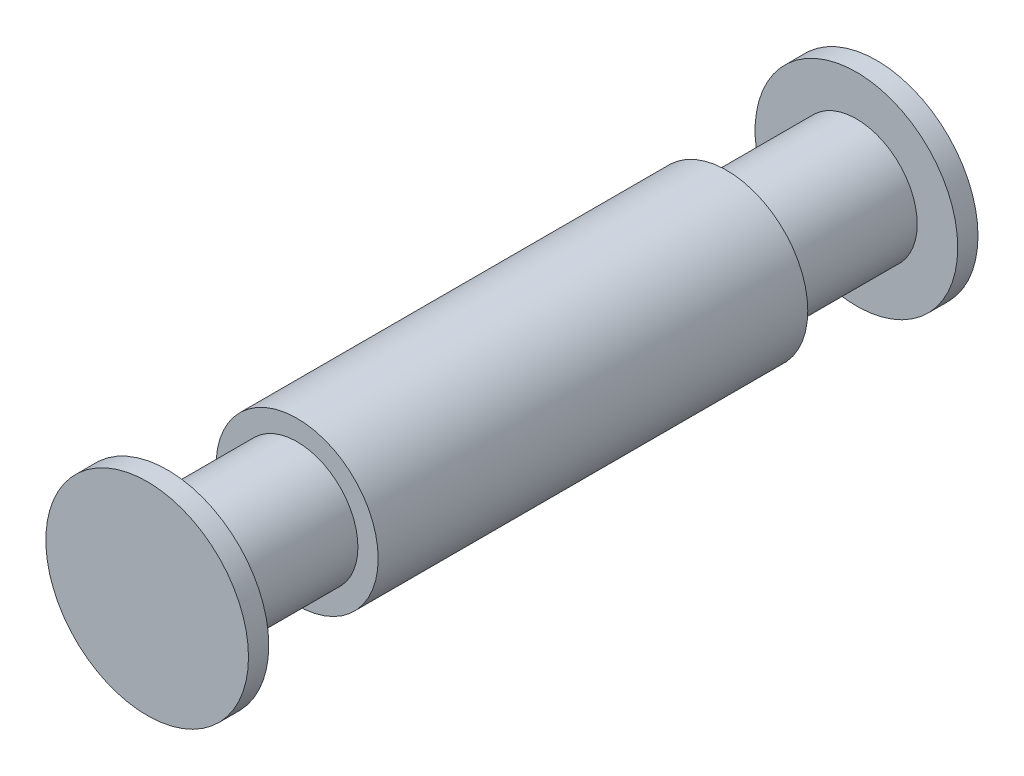
from build123d import *


with BuildPart() as part:
    # Sketch1 → Revolve1 (revolve)
    with BuildSketch(Plane(origin=(0, 0, 0), x_dir=(0, 0, -1), z_dir=(1, 0, 0)), mode=Mode.PRIVATE) as revolve1_sk:
        Polygon((-9, 0), (9, 0), (9, 2.5), (8.5, 2.5), (8.5, 1.5), (5.3, 1.5), (5.3, 2), (-5.3, 2), (-5.3, 1.5), (-8.5, 1.5), (-8.5, 2.5), (-9, 2.5), align=None)
    revolve(revolve1_sk.sketch.rotate(Axis((0, 0, 9), (0, 0, -1)), 90), axis=Axis((0, 0, 9), (0, 0, -1)))


solid = part.part
